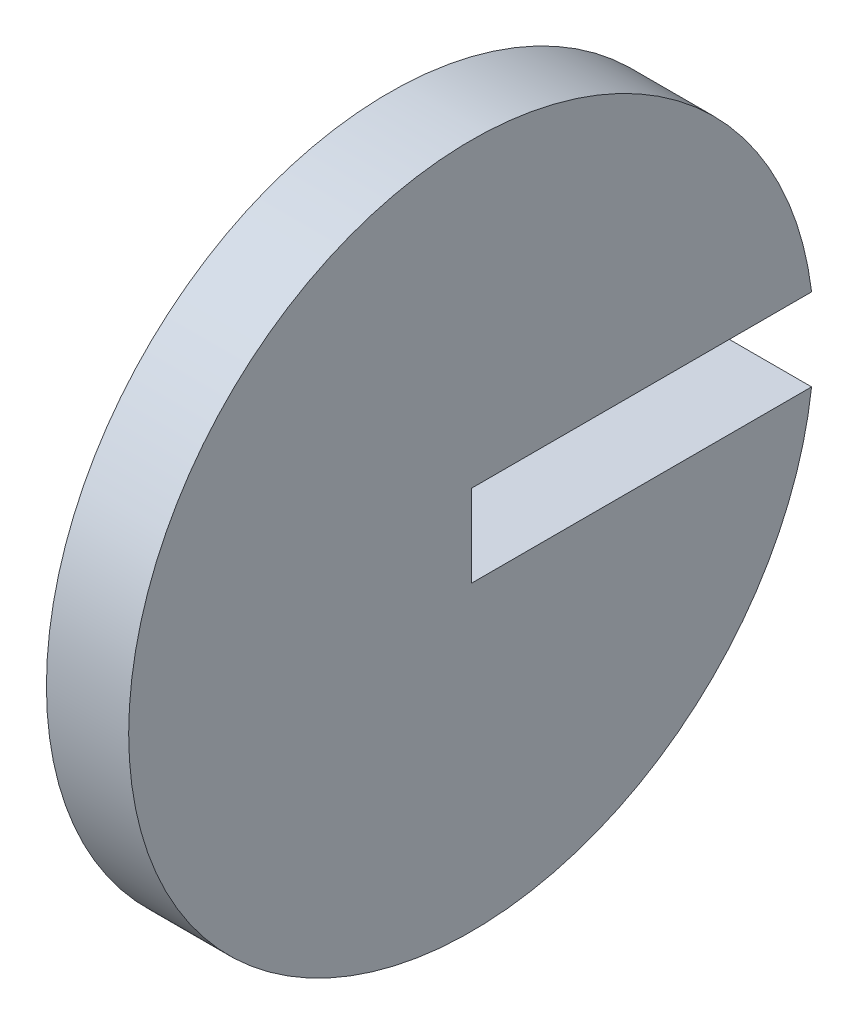
from build123d import *

# Parameters (mm, degrees)
SKETCH1_R           = 12.5
BOSS_EXTRUDE1_DEPTH = 3
SKETCH2_W           = 25
SKETCH2_H           = 3
CUT_EXTRUDE1_DEPTH  = 3


with BuildPart() as part:
    # Sketch1 → Boss-Extrude1 (new body)
    with BuildSketch(Plane(origin=(0, 0, 0), x_dir=(0, 0, -1), z_dir=(1, 0, 0))):
        Circle(SKETCH1_R)
    extrude(amount=BOSS_EXTRUDE1_DEPTH)

    # Sketch2 → Cut-Extrude1 (cut)
    with BuildSketch(Plane(origin=(3, 0, 0), x_dir=(0, 0, -1), z_dir=(1, 0, 0))):
        with Locations((12.5, 0)):
            Rectangle(SKETCH2_W, SKETCH2_H)
    extrude(amount=-CUT_EXTRUDE1_DEPTH, mode=Mode.SUBTRACT)


solid = part.part
